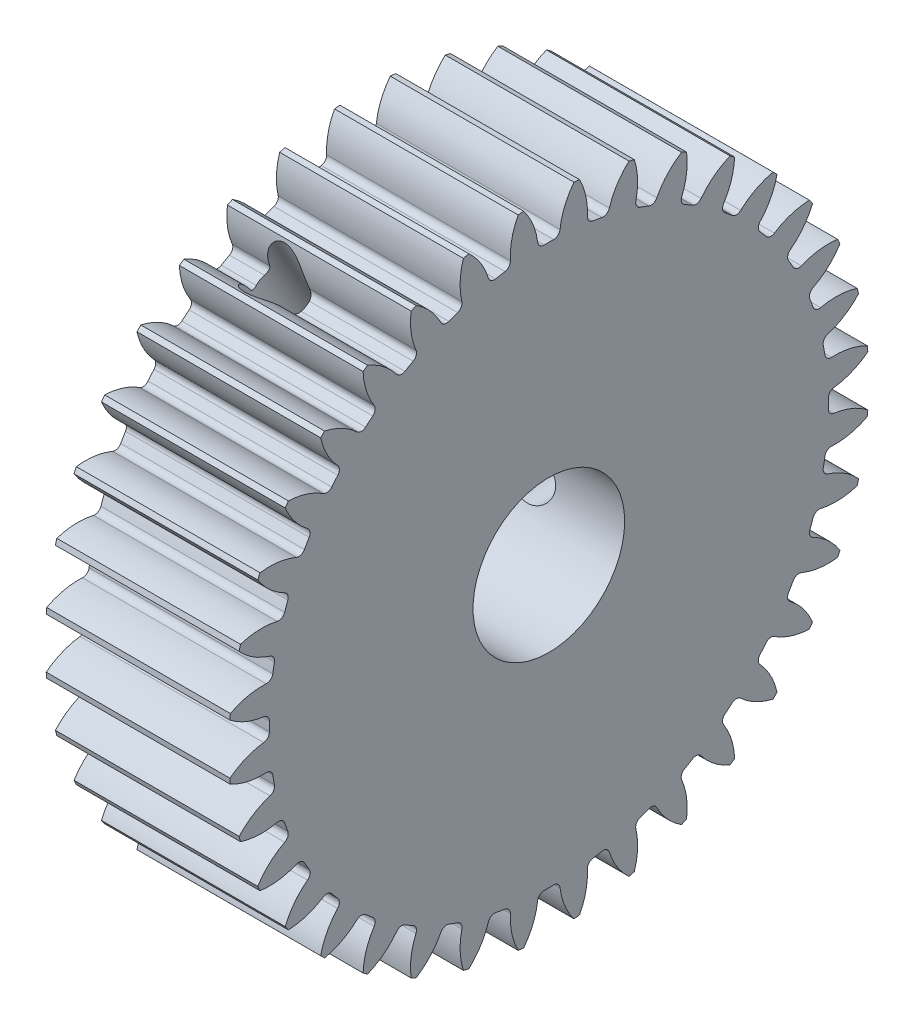
from build123d import *
from build123d.topology import SkipClean

# Parameters (mm, degrees)
SKETCH1_R                           = 20.9
SKETCH1_R_2                         = 4.953
BOSS_EXTRUDE2_DEPTH                 = 12
CUT_EXTRUDE1_DEPTH                  = 32.900156739
FILLET1_R                           = 0.418
CIRPATTERN2_COUNT                   = 36
FILLET1_OF_CIRPATTERN2_R            = 0.418
SKETCH4_R                           = 1.5
CUT_EXTRUDE2_DEPTH                  = 36.258434949
CUT_EXTRUDE2_DIRECTION_2_REACH      = 37.258
CUT_EXTRUDE2_DIRECTION_2_END_RADIUS = 4.953
SKETCH5_R                           = 1.5
CUT_EXTRUDE3_DEPTH                  = 37.313954478
CUT_EXTRUDE3_DIRECTION_2_REACH      = 38.314
CUT_EXTRUDE3_DIRECTION_2_END_RADIUS = 4.953
SKETCH6_R                           = 1.5
CUT_EXTRUDE4_DEPTH                  = 37.313954478
CUT_EXTRUDE4_DIRECTION_2_REACH      = 38.314
CUT_EXTRUDE4_DIRECTION_2_END_RADIUS = 4.953


with BuildPart() as part:
    # Sketch1 → Boss-Extrude2 (new body)
    with BuildSketch(Plane(origin=(0, 0, 0), x_dir=(0, 0, -1), z_dir=(1, 0, 0))):
        Circle(SKETCH1_R)
        Circle(SKETCH1_R_2, mode=Mode.SUBTRACT)
    extrude(amount=BOSS_EXTRUDE2_DEPTH)

    # Sketch3 → Cut-Extrude1 (cut, through all)
    with BuildSketch(Plane(origin=(12, 0, 0), x_dir=(0, 0, -1), z_dir=(1, 0, 0))):
        with BuildLine():
            ThreePointArc((0.699489703, 18.246597331), (0, 18.26), (-0.699489703, 18.246597331))
            ThreePointArc((-0.699489703, 18.246597331), (-0.967863891, 19.614804062), (-1.64174367, 20.835418828))
            ThreePointArc((-1.64174367, 20.835418828), (0, 20.9), (1.64174367, 20.835418828))
            ThreePointArc((1.64174367, 20.835418828), (0.967863891, 19.614804062), (0.699489703, 18.246597331))
        make_face()
    cut_extrude1 = extrude(amount=-CUT_EXTRUDE1_DEPTH, mode=Mode.SUBTRACT)

    # Fillet1
    fillet1_edges = [part.edges().sort_by_distance(p)[0] for p in [
        (6, 18.246597331, 0.699489703),
        (6, 18.246597331, -0.699489703),
    ]]
    fillet(fillet1_edges, radius=FILLET1_R)

    # CirPattern2: Cut-Extrude1 ×36 about axis
    cirpattern2_axis = Axis((0, 0, 0), (1, 0, 0))
    for i in range(1, CIRPATTERN2_COUNT):
        add(cut_extrude1.rotate(cirpattern2_axis, i * 360 / CIRPATTERN2_COUNT), mode=Mode.SUBTRACT)

    # Fillet1 of CirPattern2
    fillet1_of_cirpattern2_edges = [part.edges().sort_by_distance(p)[0] for p in [
        (6, 17.847925405, 3.857351258),
        (6, 18.09085563, 2.479625493),
        (6, 16.906953298, 6.898009146),
        (6, 17.385432435, 5.583398522),
        (6, 15.45227197, 9.729074518),
        (6, 16.151761673, 8.517522813),
        (6, 13.528081177, 12.264526883),
        (6, 14.427327805, 11.192846483),
        (6, 11.192846483, 14.427327805),
        (6, 12.264526883, 13.528081177),
        (6, 8.517522813, 16.151761673),
        (6, 9.729074518, 15.45227197),
        (6, 5.583398522, 17.385432435),
        (6, 6.898009146, 16.906953298),
        (6, 2.479625493, 18.09085563),
        (6, 3.857351258, 17.847925405),
        (6, -0.699489703, 18.246597331),
        (6, 0.699489703, 18.246597331),
        (6, -3.857351258, 17.847925405),
        (6, -2.479625493, 18.09085563),
        (6, -6.898009146, 16.906953298),
        (6, -5.583398522, 17.385432435),
        (6, -9.729074518, 15.45227197),
        (6, -8.517522813, 16.151761673),
        (6, -12.264526883, 13.528081177),
        (6, -11.192846483, 14.427327805),
        (6, -14.427327805, 11.192846483),
        (6, -13.528081177, 12.264526883),
        (6, -16.151761673, 8.517522813),
        (6, -15.45227197, 9.729074518),
        (6, -17.385432435, 5.583398522),
        (6, -16.906953298, 6.898009146),
        (6, -18.09085563, 2.479625493),
        (6, -17.847925405, 3.857351258),
        (6, -18.246597331, -0.699489703),
        (6, -18.246597331, 0.699489703),
        (6, -17.847925405, -3.857351258),
        (6, -18.09085563, -2.479625493),
        (6, -16.906953298, -6.898009146),
        (6, -17.385432435, -5.583398522),
        (6, -15.45227197, -9.729074518),
        (6, -16.151761673, -8.517522813),
        (6, -13.528081177, -12.264526883),
        (6, -14.427327805, -11.192846483),
        (6, -11.192846483, -14.427327805),
        (6, -12.264526883, -13.528081177),
        (6, -8.517522813, -16.151761673),
        (6, -9.729074518, -15.45227197),
        (6, -5.583398522, -17.385432435),
        (6, -6.898009146, -16.906953298),
        (6, -2.479625493, -18.09085563),
        (6, -3.857351258, -17.847925405),
        (6, 0.699489703, -18.246597331),
        (6, -0.699489703, -18.246597331),
        (6, 3.857351258, -17.847925405),
        (6, 2.479625493, -18.09085563),
        (6, 6.898009146, -16.906953298),
        (6, 5.583398522, -17.385432435),
        (6, 9.729074518, -15.45227197),
        (6, 8.517522813, -16.151761673),
        (6, 12.264526883, -13.528081177),
        (6, 11.192846483, -14.427327805),
        (6, 14.427327805, -11.192846483),
        (6, 13.528081177, -12.264526883),
        (6, 16.151761673, -8.517522813),
        (6, 15.45227197, -9.729074518),
        (6, 17.385432435, -5.583398522),
        (6, 16.906953298, -6.898009146),
        (6, 18.09085563, -2.479625493),
        (6, 17.847925405, -3.857351258),
    ]]
    fillet(fillet1_of_cirpattern2_edges, radius=FILLET1_OF_CIRPATTERN2_R)

    # Sketch4 → Cut-Extrude2 (cut)
    with BuildSketch(Plane.XY.offset(-4.953)):
        with Locations(Location((6, -0.307994897, 0), (0, 0, 180))):
            Circle(SKETCH4_R)
    extrude(amount=-CUT_EXTRUDE2_DEPTH, mode=Mode.SUBTRACT)

    # Cut-Extrude2 direction 2: up to this cylinder (the profile starts outside it)
    with SkipClean():  # the faces are left unmerged after this step: merging them gives an invalid solid
        cut_extrude2_direction_2_end = Plane(origin=(6, 0, 0), z_dir=(-1, 0, 0)) * Cylinder(CUT_EXTRUDE2_DIRECTION_2_END_RADIUS, 85.422, mode=Mode.PRIVATE)
        # Sketch4 → Cut-Extrude2 direction 2 (cut, up to the surface)
        with BuildSketch(Plane.XY.offset(-4.953), mode=Mode.PRIVATE) as cut_extrude2_direction_2_sk1:
            with Locations(Location((6, -0.307994897, 0), (0, 0, 180))):
                Circle(SKETCH4_R)
        cut_extrude2_direction_2_tool1 = extrude(cut_extrude2_direction_2_sk1.sketch, amount=CUT_EXTRUDE2_DIRECTION_2_REACH, mode=Mode.PRIVATE) - cut_extrude2_direction_2_end
        add(cut_extrude2_direction_2_tool1.solids().sort_by_distance((6, -0.307995, -4.953))[0], mode=Mode.SUBTRACT)
        add(cut_extrude2_direction_2_tool1.solids().sort_by_distance((6, -0.307995, -4.953))[1], mode=Mode.SUBTRACT)

    # Sketch5 → Cut-Extrude3 (cut)
    with BuildSketch(Plane(origin=(0, 4.289423825, 2.4765), x_dir=(-1, 0, 0), z_dir=(0, -0.8660254037844398, -0.499999999999998))):
        with Locations(Location((-3.75, 0, 0), (0, 0, 29.118029084))):
            Circle(SKETCH5_R)
    extrude(amount=-CUT_EXTRUDE3_DEPTH, mode=Mode.SUBTRACT)

    # Cut-Extrude3 direction 2: up to this cylinder (the profile starts outside it)
    with SkipClean():  # the faces are left unmerged after this step: merging them gives an invalid solid
        cut_extrude3_direction_2_end = Plane(origin=(3.75, 0, 0), z_dir=(-1, 0, 0)) * Cylinder(CUT_EXTRUDE3_DIRECTION_2_END_RADIUS, 87.534, mode=Mode.PRIVATE)
        # Sketch5 → Cut-Extrude3 direction 2 (cut, up to the surface)
        with BuildSketch(Plane(origin=(0, 4.289423825, 2.4765), x_dir=(-1, 0, 0), z_dir=(0, -0.8660254037844398, -0.499999999999998)), mode=Mode.PRIVATE) as cut_extrude3_direction_2_sk1:
            with Locations(Location((-3.75, 0, 0), (0, 0, 29.118029084))):
                Circle(SKETCH5_R)
        cut_extrude3_direction_2_tool1 = extrude(cut_extrude3_direction_2_sk1.sketch, amount=CUT_EXTRUDE3_DIRECTION_2_REACH, mode=Mode.PRIVATE) - cut_extrude3_direction_2_end
        add(cut_extrude3_direction_2_tool1.solids().sort_by_distance((3.75, 4.289424, 2.4765))[0], mode=Mode.SUBTRACT)
        add(cut_extrude3_direction_2_tool1.solids().sort_by_distance((3.75, 4.289424, 2.4765))[1], mode=Mode.SUBTRACT)

    # Sketch6 → Cut-Extrude4 (cut)
    with BuildSketch(Plane(origin=(0, -4.289423825, 2.4765), x_dir=(-1, 0, 0), z_dir=(0, 0.8660254037844364, -0.500000000000004))):
        with Locations(Location((-3.75, 0, 0), (0, 0, 29.118029084))):
            Circle(SKETCH6_R)
    extrude(amount=-CUT_EXTRUDE4_DEPTH, mode=Mode.SUBTRACT)

    # Cut-Extrude4 direction 2: up to this cylinder (the profile starts outside it)
    with SkipClean():  # the faces are left unmerged after this step: merging them gives an invalid solid
        cut_extrude4_direction_2_end = Plane(origin=(3.75, 0, 0), z_dir=(-1, 0, 0)) * Cylinder(CUT_EXTRUDE4_DIRECTION_2_END_RADIUS, 87.534, mode=Mode.PRIVATE)
        # Sketch6 → Cut-Extrude4 direction 2 (cut, up to the surface)
        with BuildSketch(Plane(origin=(0, -4.289423825, 2.4765), x_dir=(-1, 0, 0), z_dir=(0, 0.8660254037844364, -0.500000000000004)), mode=Mode.PRIVATE) as cut_extrude4_direction_2_sk1:
            with Locations(Location((-3.75, 0, 0), (0, 0, 29.118029084))):
                Circle(SKETCH6_R)
        cut_extrude4_direction_2_tool1 = extrude(cut_extrude4_direction_2_sk1.sketch, amount=CUT_EXTRUDE4_DIRECTION_2_REACH, mode=Mode.PRIVATE) - cut_extrude4_direction_2_end
        add(cut_extrude4_direction_2_tool1.solids().sort_by_distance((3.75, -4.289424, 2.4765))[0], mode=Mode.SUBTRACT)
        add(cut_extrude4_direction_2_tool1.solids().sort_by_distance((3.75, -4.289424, 2.4765))[1], mode=Mode.SUBTRACT)


solid = part.part
